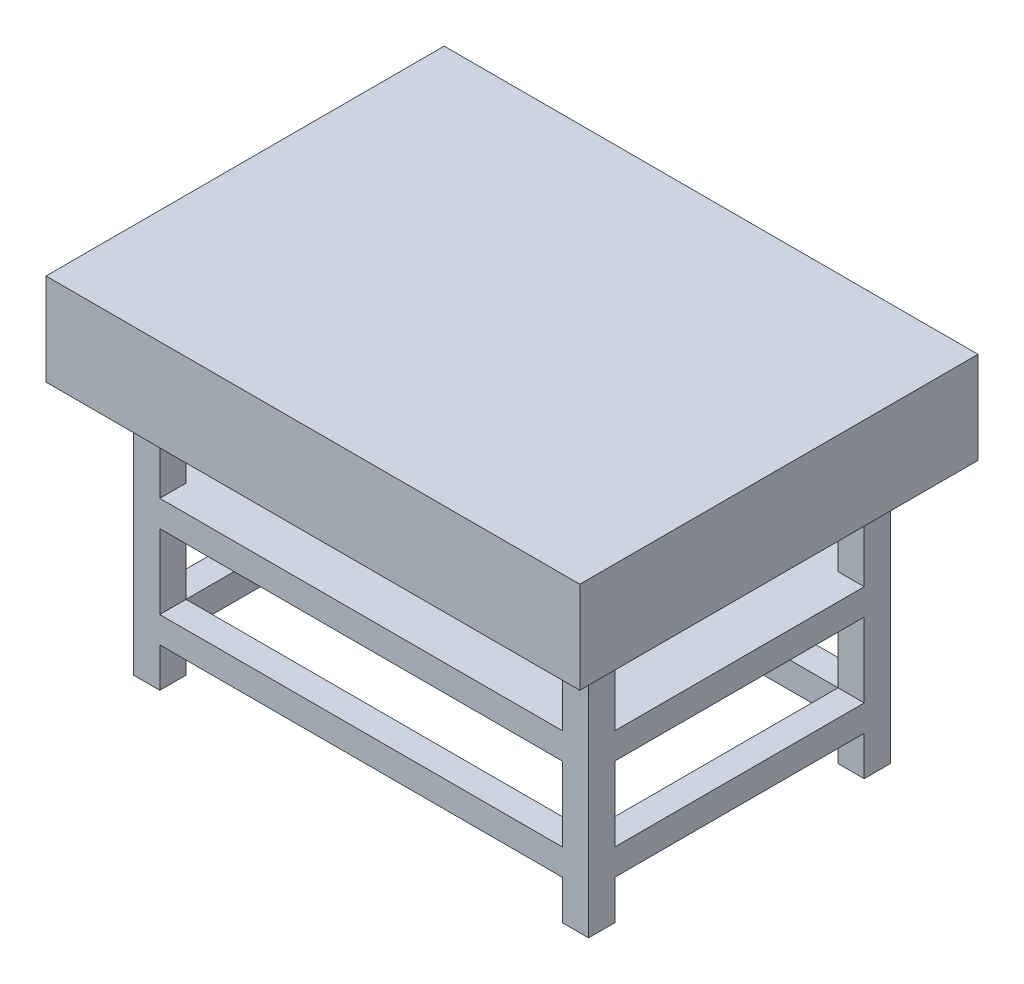
from build123d import *

# Parameters (mm, degrees)
SKETCH_1_W      = 1220
SKETCH_1_H      = 910
EXTRUDE_1_DEPTH = 210
SKETCH_2_W      = 60
SKETCH_2_H      = 730
SKETCH_2_W_2    = 920
SKETCH_2_H_2    = 60
EXTRUDE_2_DEPTH = 60
SKETCH_3_W      = 60
SKETCH_3_H      = 60
EXTRUDE_3_DEPTH = 530
EXTRUDE_4_REACH = 1546.053
SKETCH_4_W      = 60
SKETCH_4_H      = 60
EXTRUDE_5_REACH = 1525.516
SKETCH_5_W      = 60
SKETCH_5_H      = 60
SKETCH_6_W      = 690
SKETCH_6_H      = 60
EXTRUDE_7_DEPTH = 980


with BuildPart() as part:
    # ｽｹｯﾁ1 → ﾎﾞｽ - 押し出し1 (new body)
    with BuildSketch(Plane(origin=(0, 0, 0), x_dir=(1, 0, 0), z_dir=(0, 1, 0))):
        with Locations((610, 455)):
            Rectangle(SKETCH_1_W, SKETCH_1_H)
    extrude(amount=EXTRUDE_1_DEPTH)

    # ｽｹｯﾁ2 → ﾎﾞｽ - 押し出し2 (add)
    with BuildSketch(Plane.XZ):
        with Locations((120, -455)):
            Rectangle(SKETCH_2_W, SKETCH_2_H)
        with Locations((610, -140)):
            Rectangle(SKETCH_2_W_2, SKETCH_2_H_2)
        with Locations((610, -770)):
            Rectangle(SKETCH_2_W_2, SKETCH_2_H_2)
        with Locations((1100, -455)):
            Rectangle(SKETCH_2_W, SKETCH_2_H)
    extrude(amount=EXTRUDE_2_DEPTH)

    # ｽｹｯﾁ3 → ﾎﾞｽ - 押し出し3 (add)
    with BuildSketch(Plane(origin=(0, -60, 0), x_dir=(-1, 0, 0), z_dir=(0, -1, 0))):
        with Locations((-120, 140)):
            Rectangle(SKETCH_3_W, SKETCH_3_H)
        with Locations((-1100, 140)):
            Rectangle(SKETCH_3_W, SKETCH_3_H)
        with Locations((-1100, 770)):
            Rectangle(SKETCH_3_W, SKETCH_3_H)
        with Locations((-120, 770)):
            Rectangle(SKETCH_3_W, SKETCH_3_H)
    extrude(amount=EXTRUDE_3_DEPTH)

    # ｽｹｯﾁ4 → ﾎﾞｽ - 押し出し4 (add, up to next)
    with BuildSketch(Plane(origin=(0, 0, -170), x_dir=(-1, 0, 0), z_dir=(0, 0, -1)), mode=Mode.PRIVATE) as extrude_4_sk1:
        with Locations((-120, -470)):
            Rectangle(SKETCH_4_W, SKETCH_4_H)
    extrude_4_tool1 = extrude(extrude_4_sk1.sketch, amount=EXTRUDE_4_REACH, mode=Mode.PRIVATE) - part.part
    # ｽｹｯﾁ4 → ﾎﾞｽ - 押し出し4 (add, up to next)
    with BuildSketch(Plane(origin=(0, 0, -170), x_dir=(-1, 0, 0), z_dir=(0, 0, -1)), mode=Mode.PRIVATE) as extrude_4_sk2:
        with Locations((-120, -240)):
            Rectangle(SKETCH_4_W, SKETCH_4_H)
    extrude_4_tool2 = extrude(extrude_4_sk2.sketch, amount=EXTRUDE_4_REACH, mode=Mode.PRIVATE) - part.part
    # ｽｹｯﾁ4 → ﾎﾞｽ - 押し出し4 (add, up to next)
    with BuildSketch(Plane(origin=(0, 0, -170), x_dir=(-1, 0, 0), z_dir=(0, 0, -1)), mode=Mode.PRIVATE) as extrude_4_sk3:
        with Locations((-1100, -240)):
            Rectangle(SKETCH_4_W, SKETCH_4_H)
    extrude_4_tool3 = extrude(extrude_4_sk3.sketch, amount=EXTRUDE_4_REACH, mode=Mode.PRIVATE) - part.part
    # ｽｹｯﾁ4 → ﾎﾞｽ - 押し出し4 (add, up to next)
    with BuildSketch(Plane(origin=(0, 0, -170), x_dir=(-1, 0, 0), z_dir=(0, 0, -1)), mode=Mode.PRIVATE) as extrude_4_sk4:
        with Locations((-1100, -470)):
            Rectangle(SKETCH_4_W, SKETCH_4_H)
    extrude_4_tool4 = extrude(extrude_4_sk4.sketch, amount=EXTRUDE_4_REACH, mode=Mode.PRIVATE) - part.part
    add(extrude_4_tool1.solids().sort_by_distance((120, -470, -170))[0])
    add(extrude_4_tool2.solids().sort_by_distance((120, -240, -170))[0])
    add(extrude_4_tool3.solids().sort_by_distance((1100, -240, -170))[0])
    add(extrude_4_tool4.solids().sort_by_distance((1100, -470, -170))[0])

    # ｽｹｯﾁ5 → ﾎﾞｽ - 押し出し5 (add, up to next)
    with BuildSketch(Plane(origin=(150, 0, 0), x_dir=(0, 0, -1), z_dir=(1, 0, 0)), mode=Mode.PRIVATE) as extrude_5_sk1:
        with Locations((770, -470)):
            Rectangle(SKETCH_5_W, SKETCH_5_H)
    extrude_5_tool1 = extrude(extrude_5_sk1.sketch, amount=EXTRUDE_5_REACH, mode=Mode.PRIVATE) - part.part
    # ｽｹｯﾁ5 → ﾎﾞｽ - 押し出し5 (add, up to next)
    with BuildSketch(Plane(origin=(150, 0, 0), x_dir=(0, 0, -1), z_dir=(1, 0, 0)), mode=Mode.PRIVATE) as extrude_5_sk2:
        with Locations((140, -470)):
            Rectangle(SKETCH_5_W, SKETCH_5_H)
    extrude_5_tool2 = extrude(extrude_5_sk2.sketch, amount=EXTRUDE_5_REACH, mode=Mode.PRIVATE) - part.part
    add(extrude_5_tool1.solids().sort_by_distance((150, -470, -770))[0])
    add(extrude_5_tool2.solids().sort_by_distance((150, -470, -140))[0])

    # ｽｹｯﾁ6 → ﾎﾞｽ - 押し出し7 (add)
    with BuildSketch(Plane.ZY.offset(-1070)):
        with Locations((-455, -240)):
            Rectangle(SKETCH_6_W, SKETCH_6_H)
    extrude(amount=EXTRUDE_7_DEPTH)


solid = part.part
